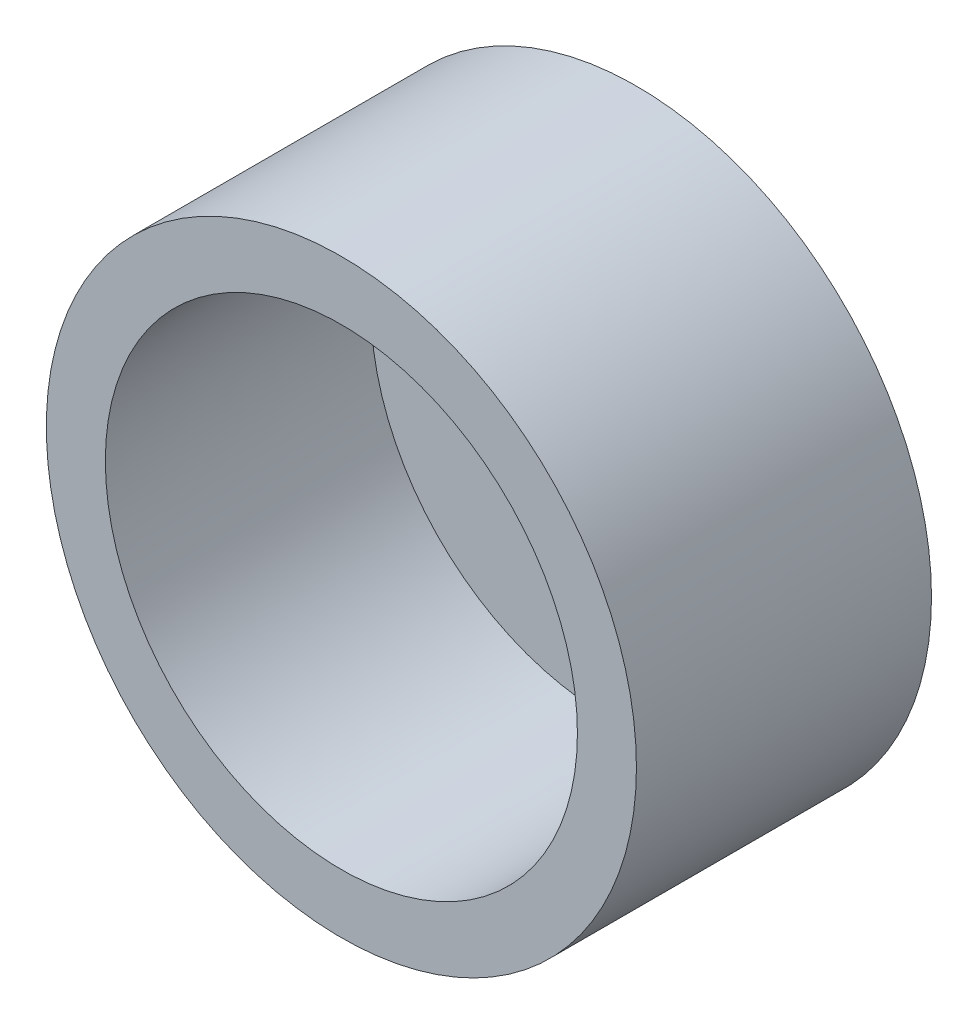
from build123d import *

# Parameters (mm, degrees)
SKETCH1_R           = 5
BOSS_EXTRUDE1_DEPTH = 5
SKETCH3_R           = 4
CUT_EXTRUDE1_DEPTH  = 4.5
SKETCH4_R           = 0.3
CUT_EXTRUDE2_DEPTH  = 9.381527307


with BuildPart() as part:
    # Sketch1 → Boss-Extrude1 (new body)
    with BuildSketch(Plane.XY):
        Circle(SKETCH1_R)
    extrude(amount=BOSS_EXTRUDE1_DEPTH)

    # Sketch3 → Cut-Extrude1 (cut)
    with BuildSketch(Plane.XY.offset(5)):
        Circle(SKETCH3_R)
    extrude(amount=-CUT_EXTRUDE1_DEPTH, mode=Mode.SUBTRACT)

    # Sketch4 → Cut-Extrude2 (cut, through all)
    with BuildSketch(Plane.XY.offset(0.5)):
        with Locations((1.29, 0)):
            Circle(SKETCH4_R)
        with Locations((-1.29, 0)):
            Circle(SKETCH4_R)
    extrude(amount=-CUT_EXTRUDE2_DEPTH, mode=Mode.SUBTRACT)


solid = part.part
